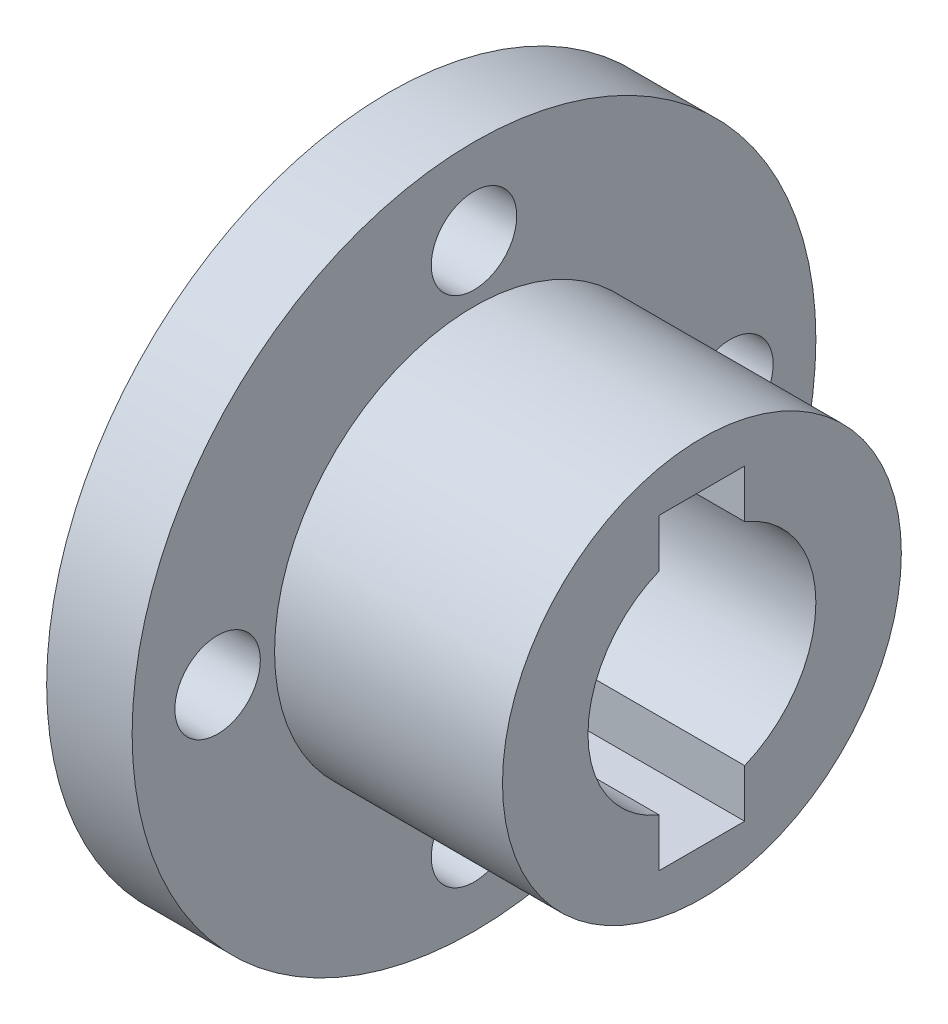
from build123d import *

# Parameters (mm, degrees)
CUT_EXTRUDE_1_DEPTH = 21.223748416
CUT_EXTRUDE_2_REACH = 20.762
SKETCH_3_R          = 1.5
SKETCH_5_R          = 1.7
CUT_EXTRUDE_3_DEPTH = 21.223748416
SKETCH_6_R          = 4
CUT_EXTRUDE_4_DEPTH = 19.761663039


with BuildPart() as part:
    # 草图1 → 旋转1 (revolve)
    with BuildSketch(Plane(origin=(0, 0, 0), x_dir=(1, 0, 0), z_dir=(0, 1, 0))):
        Polygon((0, 0), (0, 12), (3, 12), (3, 7), (11, 7), (11, 4), (3, 4), (3, 0), align=None)
    revolve(axis=Axis((3, 0, 0), (-1, 0, 0)))

    # 草图2 → 切除-拉伸1 (cut, through all)
    with BuildSketch(Plane(origin=(11, 0, 0), x_dir=(0, 0, -1), z_dir=(1, 0, 0))):
        with BuildLine():
            Line((1.5, -5.4), (1.5, -3.708099244))
            ThreePointArc((1.5, -3.708099244), (0, -4), (-1.5, -3.708099244))
            Line((-1.5, -3.708099244), (-1.5, -5.4))
            Line((-1.5, -5.4), (1.5, -5.4))
        make_face()
        with BuildLine():
            Line((-1.5, 5.4), (1.5, 5.4))
            Line((1.5, 5.4), (1.5, 3.708099244))
            ThreePointArc((1.5, 3.708099244), (0, 4), (-1.5, 3.708099244))
            Line((-1.5, 3.708099244), (-1.5, 5.4))
        make_face()
    extrude(amount=-CUT_EXTRUDE_1_DEPTH, mode=Mode.SUBTRACT)

    # 草图3 → 切除-拉伸2 (cut, up to next)
    with BuildSketch(Plane(origin=(3, 0, 0), x_dir=(0, 0, -1), z_dir=(1, 0, 0)), mode=Mode.PRIVATE) as cut_extrude_2_sk1:
        with Locations((0, 9)):
            Circle(SKETCH_3_R)
    cut_extrude_2_tool1 = extrude(cut_extrude_2_sk1.sketch, amount=-CUT_EXTRUDE_2_REACH, mode=Mode.PRIVATE) & part.part
    # 草图3 → 切除-拉伸2 (cut, up to next)
    with BuildSketch(Plane(origin=(3, 0, 0), x_dir=(0, 0, -1), z_dir=(1, 0, 0)), mode=Mode.PRIVATE) as cut_extrude_2_sk2:
        with Locations((9, 0)):
            Circle(SKETCH_3_R)
    cut_extrude_2_tool2 = extrude(cut_extrude_2_sk2.sketch, amount=-CUT_EXTRUDE_2_REACH, mode=Mode.PRIVATE) & part.part
    # 草图3 → 切除-拉伸2 (cut, up to next)
    with BuildSketch(Plane(origin=(3, 0, 0), x_dir=(0, 0, -1), z_dir=(1, 0, 0)), mode=Mode.PRIVATE) as cut_extrude_2_sk3:
        with Locations((0, -9)):
            Circle(SKETCH_3_R)
    cut_extrude_2_tool3 = extrude(cut_extrude_2_sk3.sketch, amount=-CUT_EXTRUDE_2_REACH, mode=Mode.PRIVATE) & part.part
    # 草图3 → 切除-拉伸2 (cut, up to next)
    with BuildSketch(Plane(origin=(3, 0, 0), x_dir=(0, 0, -1), z_dir=(1, 0, 0)), mode=Mode.PRIVATE) as cut_extrude_2_sk4:
        with Locations((-9, 0)):
            Circle(SKETCH_3_R)
    cut_extrude_2_tool4 = extrude(cut_extrude_2_sk4.sketch, amount=-CUT_EXTRUDE_2_REACH, mode=Mode.PRIVATE) & part.part
    add(cut_extrude_2_tool1.solids().sort_by_distance((3, 9, 0))[0], mode=Mode.SUBTRACT)
    add(cut_extrude_2_tool2.solids().sort_by_distance((3, 0, -9))[0], mode=Mode.SUBTRACT)
    add(cut_extrude_2_tool3.solids().sort_by_distance((3, -9, 0))[0], mode=Mode.SUBTRACT)
    add(cut_extrude_2_tool4.solids().sort_by_distance((3, 0, 9))[0], mode=Mode.SUBTRACT)

    # 草图5 → 切除-拉伸3 (cut, through all)
    with BuildSketch(Plane.ZY):
        Circle(SKETCH_5_R)
    extrude(amount=-CUT_EXTRUDE_3_DEPTH, mode=Mode.SUBTRACT)

    # 草图6 → 切除-拉伸4 (cut, through all)
    with BuildSketch(Plane(origin=(3, 0, 0), x_dir=(0, 0, -1), z_dir=(1, 0, 0))):
        Circle(SKETCH_6_R)
    extrude(amount=-CUT_EXTRUDE_4_DEPTH, mode=Mode.SUBTRACT)


solid = part.part
